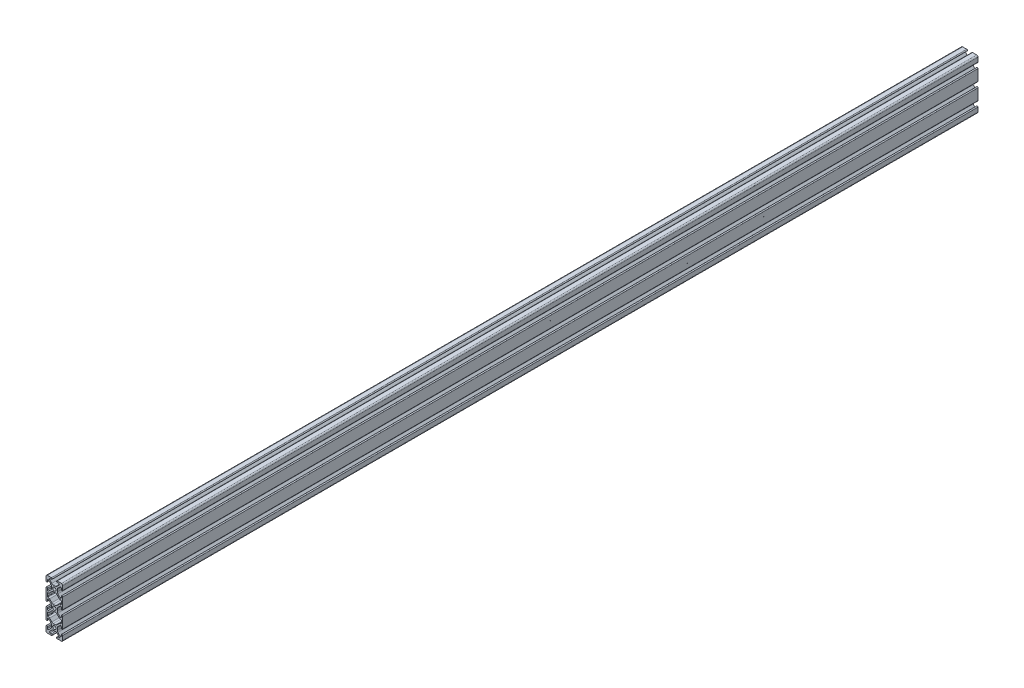
from build123d import *

# Parameters (mm, degrees)
SKETCH1_R      = 2.5
EXTRUDE1_DEPTH = 1371.6


with BuildPart() as part:
    # Sketch1 → Extrude1 (new body)
    with BuildSketch(Plane.XY):
        with BuildLine():
            Line((10.359994631, 56.429997403), (10.359989144, 54.32))
            ThreePointArc((10.359989144, 54.32), (11.429994572, 53.249994572), (12.5, 54.32))
            Line((12.5, 54.32), (12.5, 60.5))
            ThreePointArc((12.5, 60.5), (11.914213562, 61.914213562), (10.5, 62.5))
            Line((10.5, 62.5), (4.32, 62.5))
            ThreePointArc((4.32, 62.5), (3.25, 61.429994572), (4.32, 60.359989144))
            Line((4.32, 60.359989144), (6.429506446, 60.359994631))
            ThreePointArc((6.429506446, 60.359994631), (7.35320663, 59.743115807), (7.139431986, 58.653133278))
            Line((7.139431986, 58.653133278), (3.790027931, 55.303236443))
            ThreePointArc((3.790027931, 55.303236443), (2.761605915, 54.616066821), (1.548499435, 54.374764939))
            Line((1.548499435, 54.374764939), (-1.548499435, 54.374764939))
            ThreePointArc((-1.548499435, 54.374764939), (-2.761605915, 54.616066821), (-3.790027931, 55.303236443))
            Line((-3.790027931, 55.303236443), (-7.138393059, 58.651601571))
            ThreePointArc((-7.138393059, 58.651601571), (-7.354112119, 59.742117633), (-6.429997403, 60.359994631))
            Line((-6.429997403, 60.359994631), (-4.32, 60.359989144))
            ThreePointArc((-4.32, 60.359989144), (-3.25, 61.429994572), (-4.32, 62.5))
            Line((-4.32, 62.5), (-10.5, 62.5))
            ThreePointArc((-10.5, 62.5), (-11.914213562, 61.914213562), (-12.5, 60.5))
            Line((-12.5, 60.5), (-12.5, 54.32))
            ThreePointArc((-12.5, 54.32), (-11.429994572, 53.25), (-10.359989144, 54.32))
            Line((-10.359989144, 54.32), (-10.359994631, 56.429506446))
            ThreePointArc((-10.359994631, 56.429506446), (-9.743115807, 57.35320663), (-8.653133278, 57.139431986))
            Line((-8.653133278, 57.139431986), (-5.303236443, 53.790027931))
            ThreePointArc((-5.303236443, 53.790027931), (-4.616066821, 52.761605915), (-4.374764939, 51.548499435))
            Line((-4.374764939, 51.548499435), (-4.374764939, 48.451500565))
            ThreePointArc((-4.374764939, 48.451500565), (-4.616066821, 47.238394085), (-5.303236443, 46.209972069))
            Line((-5.303236443, 46.209972069), (-8.651601571, 42.861606941))
            ThreePointArc((-8.651601571, 42.861606941), (-9.742117633, 42.645887881), (-10.359994631, 43.570002597))
            Line((-10.359994631, 43.570002597), (-10.359989144, 45.68))
            ThreePointArc((-10.359989144, 45.68), (-11.429994572, 46.75), (-12.5, 45.68))
            Line((-12.5, 45.68), (-12.5, 29.32))
            ThreePointArc((-12.5, 29.32), (-11.429994572, 28.25), (-10.359989144, 29.32))
            Line((-10.359989144, 29.32), (-10.359994631, 31.429506446))
            ThreePointArc((-10.359994631, 31.429506446), (-9.743115807, 32.35320663), (-8.653133278, 32.139431986))
            Line((-8.653133278, 32.139431986), (-5.303236443, 28.790027931))
            ThreePointArc((-5.303236443, 28.790027931), (-4.616066821, 27.761605915), (-4.374764939, 26.548499435))
            Line((-4.374764939, 26.548499435), (-4.374764939, 23.451500565))
            ThreePointArc((-4.374764939, 23.451500565), (-4.616066821, 22.238394085), (-5.303236443, 21.209972069))
            Line((-5.303236443, 21.209972069), (-8.651601571, 17.861606941))
            ThreePointArc((-8.651601571, 17.861606941), (-9.742117633, 17.645887881), (-10.359994631, 18.570002597))
            Line((-10.359994631, 18.570002597), (-10.359989144, 20.68))
            ThreePointArc((-10.359989144, 20.68), (-11.429994572, 21.75), (-12.5, 20.68))
            Line((-12.5, 20.68), (-12.5, 4.32))
            ThreePointArc((-12.5, 4.32), (-11.429994572, 3.25), (-10.359989144, 4.32))
            Line((-10.359989144, 4.32), (-10.359994631, 6.429506446))
            ThreePointArc((-10.359994631, 6.429506446), (-9.743115807, 7.35320663), (-8.653133278, 7.139431986))
            Line((-8.653133278, 7.139431986), (-5.303236443, 3.790027931))
            ThreePointArc((-5.303236443, 3.790027931), (-4.616066821, 2.761605915), (-4.374764939, 1.548499435))
            Line((-4.374764939, 1.548499435), (-4.374764939, -1.548499435))
            ThreePointArc((-4.374764939, -1.548499435), (-4.616066821, -2.761605915), (-5.303236443, -3.790027931))
            Line((-5.303236443, -3.790027931), (-8.651601571, -7.138393059))
            ThreePointArc((-8.651601571, -7.138393059), (-9.742114506, -7.354113415), (-10.359994624, -6.430004173))
            Line((-10.359994624, -6.430004173), (-10.359989144, -4.32))
            ThreePointArc((-10.359989144, -4.32), (-11.429994572, -3.25), (-12.5, -4.32))
            Line((-12.5, -4.32), (-12.5, -10.5))
            ThreePointArc((-12.5, -10.5), (-11.914213562, -11.914213562), (-10.5, -12.5))
            Line((-10.5, -12.5), (-4.32, -12.5))
            ThreePointArc((-4.32, -12.5), (-3.25, -11.429994572), (-4.32, -10.359989144))
            Line((-4.32, -10.359989144), (-6.429506446, -10.359994631))
            ThreePointArc((-6.429506446, -10.359994631), (-7.35320663, -9.743115807), (-7.139431986, -8.653133278))
            Line((-7.139431986, -8.653133278), (-3.790027931, -5.303236443))
            ThreePointArc((-3.790027931, -5.303236443), (-2.761605915, -4.616066821), (-1.548499435, -4.374764939))
            Line((-1.548499435, -4.374764939), (1.548499435, -4.374764939))
            ThreePointArc((1.548499435, -4.374764939), (2.761605915, -4.616066821), (3.790027931, -5.303236443))
            Line((3.790027931, -5.303236443), (7.138393059, -8.651601571))
            ThreePointArc((7.138393059, -8.651601571), (7.354112119, -9.742117633), (6.429997403, -10.359994631))
            Line((6.429997403, -10.359994631), (4.32, -10.359989144))
            ThreePointArc((4.32, -10.359989144), (3.25, -11.429994572), (4.32, -12.5))
            Line((4.32, -12.5), (10.5, -12.5))
            ThreePointArc((10.5, -12.5), (11.914213562, -11.914213562), (12.5, -10.5))
            Line((12.5, -10.5), (12.5, -4.32))
            ThreePointArc((12.5, -4.32), (11.429994572, -3.25), (10.359989144, -4.32))
            Line((10.359989144, -4.32), (10.359994631, -6.429506446))
            ThreePointArc((10.359994631, -6.429506446), (9.743115807, -7.35320663), (8.653133278, -7.139431986))
            Line((8.653133278, -7.139431986), (5.303236443, -3.790027931))
            ThreePointArc((5.303236443, -3.790027931), (4.616066821, -2.761605915), (4.374764939, -1.548499435))
            Line((4.374764939, -1.548499435), (4.374764939, 1.548499435))
            ThreePointArc((4.374764939, 1.548499435), (4.616066821, 2.761605915), (5.303236443, 3.790027931))
            Line((5.303236443, 3.790027931), (8.651601571, 7.138393059))
            ThreePointArc((8.651601571, 7.138393059), (9.742064275, 7.354134242), (10.359994624, 6.430113002))
            Line((10.359994624, 6.430113002), (10.359989144, 4.32))
            ThreePointArc((10.359989144, 4.32), (11.429994572, 3.25), (12.5, 4.32))
            Line((12.5, 4.32), (12.5, 20.68))
            ThreePointArc((12.5, 20.68), (11.429994572, 21.75), (10.359989144, 20.68))
            Line((10.359989144, 20.68), (10.359994631, 18.570493554))
            ThreePointArc((10.359994631, 18.570493554), (9.743115807, 17.64679337), (8.653133278, 17.860568014))
            Line((8.653133278, 17.860568014), (5.303236443, 21.209972069))
            ThreePointArc((5.303236443, 21.209972069), (4.616066821, 22.238394085), (4.374764939, 23.451500565))
            Line((4.374764939, 23.451500565), (4.374764939, 26.548499435))
            ThreePointArc((4.374764939, 26.548499435), (4.616066821, 27.761605915), (5.303236443, 28.790027931))
            Line((5.303236443, 28.790027931), (8.651601571, 32.138393059))
            ThreePointArc((8.651601571, 32.138393059), (9.742117633, 32.354112119), (10.359994631, 31.429997403))
            Line((10.359994631, 31.429997403), (10.359989144, 29.32))
            ThreePointArc((10.359989144, 29.32), (11.429994572, 28.25), (12.5, 29.32))
            Line((12.5, 29.32), (12.5, 45.68))
            ThreePointArc((12.5, 45.68), (11.429994572, 46.75), (10.359989144, 45.68))
            Line((10.359989144, 45.68), (10.359994631, 43.570493554))
            ThreePointArc((10.359994631, 43.570493554), (9.743115807, 42.64679337), (8.653133278, 42.860568014))
            Line((8.653133278, 42.860568014), (5.303236443, 46.209972069))
            ThreePointArc((5.303236443, 46.209972069), (4.616066821, 47.238394085), (4.374764939, 48.451500565))
            Line((4.374764939, 48.451500565), (4.374764939, 51.548499435))
            ThreePointArc((4.374764939, 51.548499435), (4.616066821, 52.761605915), (5.303236443, 53.790027931))
            Line((5.303236443, 53.790027931), (8.651601571, 57.138393059))
            ThreePointArc((8.651601571, 57.138393059), (9.742117633, 57.354112119), (10.359994631, 56.429997403))
        make_face()
        Circle(SKETCH1_R, mode=Mode.SUBTRACT)
        with Locations((0, 25)):
            Circle(SKETCH1_R, mode=Mode.SUBTRACT)
        with Locations((0, 50)):
            Circle(SKETCH1_R, mode=Mode.SUBTRACT)
        with BuildLine():
            Line((9.369848481, 15.43), (9.6, 15.43))
            ThreePointArc((9.6, 15.43), (10.137401154, 15.207401154), (10.36, 14.67))
            Line((10.36, 14.67), (10.36, 10.330489657))
            ThreePointArc((10.36, 10.330489657), (10.137401154, 9.793088504), (9.6, 9.570489657))
            Line((9.6, 9.570489657), (9.369847005, 9.570489657))
            ThreePointArc((9.369847005, 9.570489657), (8.156632812, 9.329143157), (7.128153634, 8.641853267))
            Line((7.128153634, 8.641853267), (3.790027931, 5.303236443))
            ThreePointArc((3.790027931, 5.303236443), (2.761605915, 4.616066821), (1.548499435, 4.374764939))
            Line((1.548499435, 4.374764939), (-1.548499435, 4.374764939))
            ThreePointArc((-1.548499435, 4.374764939), (-2.761605915, 4.616066821), (-3.790027931, 5.303236443))
            Line((-3.790027931, 5.303236443), (-7.128319985, 8.641528496))
            ThreePointArc((-7.128319985, 8.641528496), (-8.156742, 9.328698118), (-9.369848481, 9.57))
            Line((-9.369848481, 9.57), (-9.6, 9.57))
            ThreePointArc((-9.6, 9.57), (-10.137401154, 9.792598846), (-10.36, 10.33))
            Line((-10.36, 10.33), (-10.36, 14.669510343))
            ThreePointArc((-10.36, 14.669510343), (-10.137401154, 15.206911496), (-9.6, 15.429510343))
            Line((-9.6, 15.429510343), (-9.369847005, 15.429510343))
            ThreePointArc((-9.369847005, 15.429510343), (-8.156632812, 15.670856843), (-7.128153634, 16.358146733))
            Line((-7.128153634, 16.358146733), (-3.790027931, 19.696763557))
            ThreePointArc((-3.790027931, 19.696763557), (-2.761605915, 20.383933179), (-1.548499435, 20.625235061))
            Line((-1.548499435, 20.625235061), (1.548499435, 20.625235061))
            ThreePointArc((1.548499435, 20.625235061), (2.761605915, 20.383933179), (3.790027931, 19.696763557))
            Line((3.790027931, 19.696763557), (7.128319985, 16.358471504))
            ThreePointArc((7.128319985, 16.358471504), (8.156742, 15.671301882), (9.369848481, 15.43))
        make_face(mode=Mode.SUBTRACT)
        with BuildLine():
            Line((9.369848481, 40.43), (9.6, 40.43))
            ThreePointArc((9.6, 40.43), (10.137401154, 40.207401154), (10.36, 39.67))
            Line((10.36, 39.67), (10.36, 35.330489657))
            ThreePointArc((10.36, 35.330489657), (10.137401154, 34.793088504), (9.6, 34.570489657))
            Line((9.6, 34.570489657), (9.369847005, 34.570489657))
            ThreePointArc((9.369847005, 34.570489657), (8.156632812, 34.329143157), (7.128153634, 33.641853267))
            Line((7.128153634, 33.641853267), (3.790027931, 30.303236443))
            ThreePointArc((3.790027931, 30.303236443), (2.761605915, 29.616066821), (1.548499435, 29.374764939))
            Line((1.548499435, 29.374764939), (-1.548499435, 29.374764939))
            ThreePointArc((-1.548499435, 29.374764939), (-2.761605915, 29.616066821), (-3.790027931, 30.303236443))
            Line((-3.790027931, 30.303236443), (-7.128319985, 33.641528496))
            ThreePointArc((-7.128319985, 33.641528496), (-8.156742, 34.328698118), (-9.369848481, 34.57))
            Line((-9.369848481, 34.57), (-9.6, 34.57))
            ThreePointArc((-9.6, 34.57), (-10.137401154, 34.792598846), (-10.36, 35.33))
            Line((-10.36, 35.33), (-10.36, 39.669510343))
            ThreePointArc((-10.36, 39.669510343), (-10.137401154, 40.206911496), (-9.6, 40.429510343))
            Line((-9.6, 40.429510343), (-9.369847005, 40.429510343))
            ThreePointArc((-9.369847005, 40.429510343), (-8.156632812, 40.670856843), (-7.128153634, 41.358146733))
            Line((-7.128153634, 41.358146733), (-3.790027931, 44.696763557))
            ThreePointArc((-3.790027931, 44.696763557), (-2.761605915, 45.383933179), (-1.548499435, 45.625235061))
            Line((-1.548499435, 45.625235061), (1.548499435, 45.625235061))
            ThreePointArc((1.548499435, 45.625235061), (2.761605915, 45.383933179), (3.790027931, 44.696763557))
            Line((3.790027931, 44.696763557), (7.128319985, 41.358471504))
            ThreePointArc((7.128319985, 41.358471504), (8.156742, 40.671301882), (9.369848481, 40.43))
        make_face(mode=Mode.SUBTRACT)
    extrude(amount=-EXTRUDE1_DEPTH)


solid = part.part
